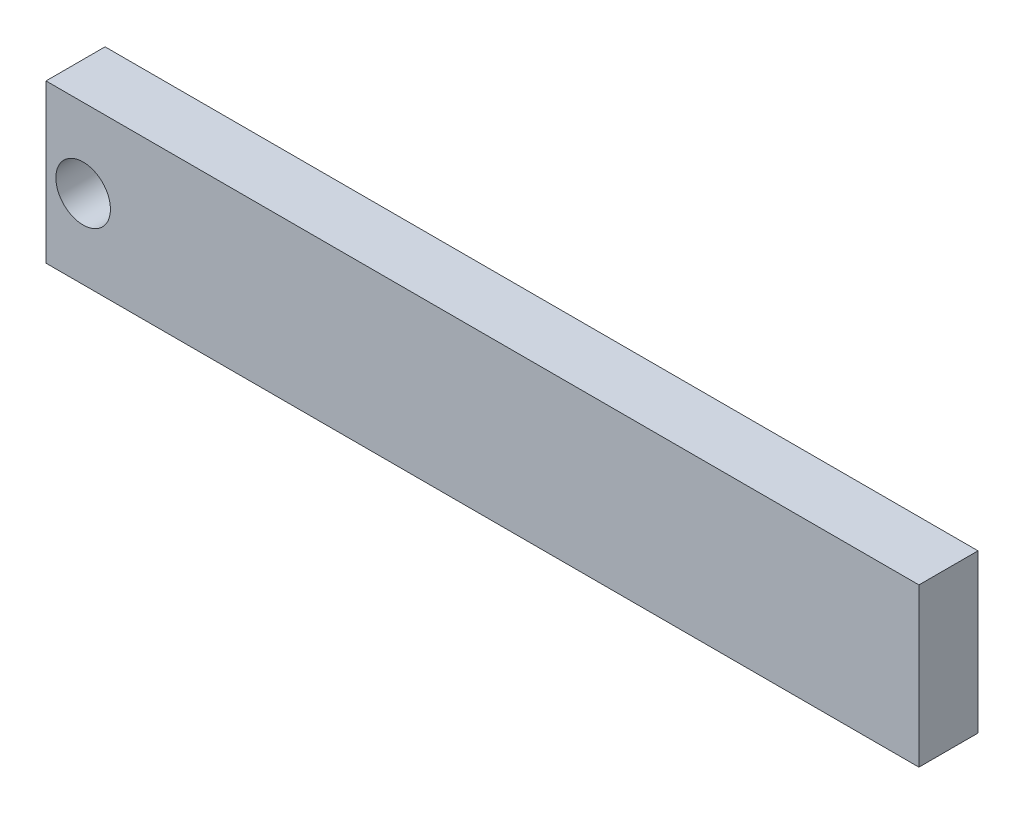
from build123d import *

# Parameters (mm, degrees)
SKETCH1_W           = 47
SKETCH1_H           = 8.5
SKETCH1_R           = 1.47
BOSS_EXTRUDE1_DEPTH = 3.18


with BuildPart() as part:
    # Sketch1 → Boss-Extrude1 (new body)
    with BuildSketch(Plane.XY):
        with Locations((23.5, 4.25)):
            Rectangle(SKETCH1_W, SKETCH1_H)
        with Locations(Location((2, 4.25, 0), (0, 0, 180))):
            Circle(SKETCH1_R, mode=Mode.SUBTRACT)
    extrude(amount=BOSS_EXTRUDE1_DEPTH)


solid = part.part
